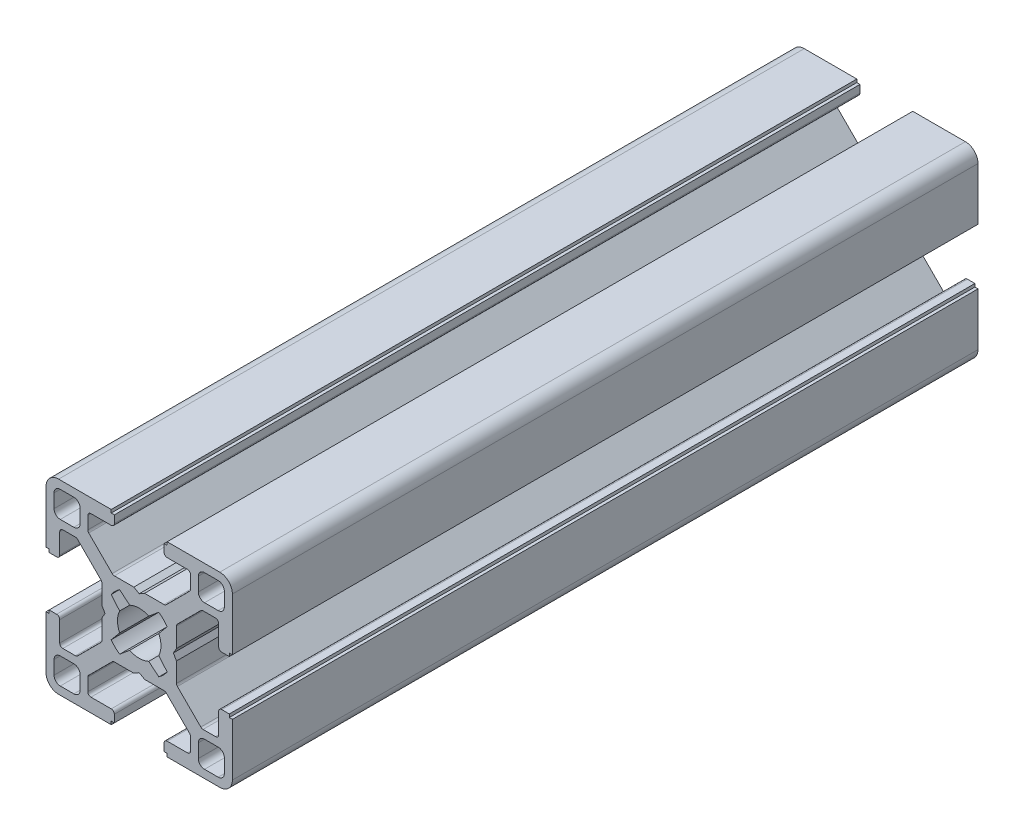
from build123d import *

# Parameters (mm, degrees)
BOSS_EXTRUDE1_DEPTH = 60
CIRPATTERN1_COUNT   = 4


with BuildPart() as part:
    # Sketch3 → Boss-Extrude1 (new, symmetric)
    with BuildSketch(Plane.XY):
        with BuildLine():
            Line((-4.503841895, 3.156803476), (-3.14772708, 1.530298739))
            ThreePointArc((-3.14772708, 1.530298739), (-3.410794979, 0.785160882), (-3.5, 0))
            Line((-3.5, 0), (-5.5, 0))
            Line((-5.5, 0), (-6, 0.866025404))
            Line((-6, 0.866025404), (-6, 3.996841995))
            ThreePointArc((-6, 3.996841995), (-6.038060234, 4.188183711), (-6.146446609, 4.350395385))
            Line((-6.146446609, 4.350395385), (-9.917104615, 8.121053391))
            ThreePointArc((-9.917104615, 8.121053391), (-10.079316289, 8.229439766), (-10.270658005, 8.2675))
            Line((-10.270658005, 8.2675), (-12.29, 8.2675))
            ThreePointArc((-12.29, 8.2675), (-12.643553391, 8.121053391), (-12.79, 7.7675))
            Line((-12.79, 7.7675), (-12.79, 4.5))
            ThreePointArc((-12.79, 4.5), (-12.936446609, 4.146446609), (-13.29, 4))
            Line((-13.29, 4), (-14.5, 4))
            Line((-14.5, 4), (-14.5, 4.5))
            Line((-14.5, 4.5), (-15, 4.5))
            Line((-15, 4.5), (-15, 12.968))
            ThreePointArc((-15, 12.968), (-14.404840979, 14.404840979), (-12.968, 15))
            Line((-12.968, 15), (-4.5, 15))
            Line((-4.5, 15), (-4.5, 14.5))
            Line((-4.5, 14.5), (-4, 14.5))
            Line((-4, 14.5), (-4, 13.29))
            ThreePointArc((-4, 13.29), (-4.146446609, 12.936446609), (-4.5, 12.79))
            Line((-4.5, 12.79), (-7.7675, 12.79))
            ThreePointArc((-7.7675, 12.79), (-8.121053391, 12.643553391), (-8.2675, 12.29))
            Line((-8.2675, 12.29), (-8.2675, 10.270658005))
            ThreePointArc((-8.2675, 10.270658005), (-8.229439766, 10.079316289), (-8.121053391, 9.917104615))
            Line((-8.121053391, 9.917104615), (-4.350395385, 6.146446609))
            ThreePointArc((-4.350395385, 6.146446609), (-4.188183711, 6.038060234), (-3.996841995, 6))
            Line((-3.996841995, 6), (-0.866025404, 6))
            Line((-0.866025404, 6), (0, 5.5))
            Line((0, 5.5), (0, 3.5))
            ThreePointArc((0, 3.5), (-0.785160882, 3.410794979), (-1.530298739, 3.14772708))
            Line((-1.530298739, 3.14772708), (-3.156803476, 4.503841895))
            ThreePointArc((-3.156803476, 4.503841895), (-3.889087297, 3.889087297), (-4.503841895, 3.156803476))
        make_face()
        with BuildLine():
            Line((-12.705, 9.5135), (-10.5135, 9.5135))
            ThreePointArc((-10.5135, 9.5135), (-9.806393219, 9.806393219), (-9.5135, 10.5135))
            Line((-9.5135, 10.5135), (-9.5135, 12.705))
            ThreePointArc((-9.5135, 12.705), (-9.806393219, 13.412106781), (-10.5135, 13.705))
            Line((-10.5135, 13.705), (-12.705, 13.705))
            ThreePointArc((-12.705, 13.705), (-13.412106781, 13.412106781), (-13.705, 12.705))
            Line((-13.705, 12.705), (-13.705, 10.5135))
            ThreePointArc((-13.705, 10.5135), (-13.412106781, 9.806393219), (-12.705, 9.5135))
        make_face(mode=Mode.SUBTRACT)
    boss_extrude1 = extrude(amount=BOSS_EXTRUDE1_DEPTH, both=True)

    # CirPattern1: Boss-Extrude1 ×4 about axis
    cirpattern1_axis = Axis((0, 0, 0), (0, 0, 1))
    for i in range(1, CIRPATTERN1_COUNT):
        add(boss_extrude1.rotate(cirpattern1_axis, i * 360 / CIRPATTERN1_COUNT))


solid = part.part
